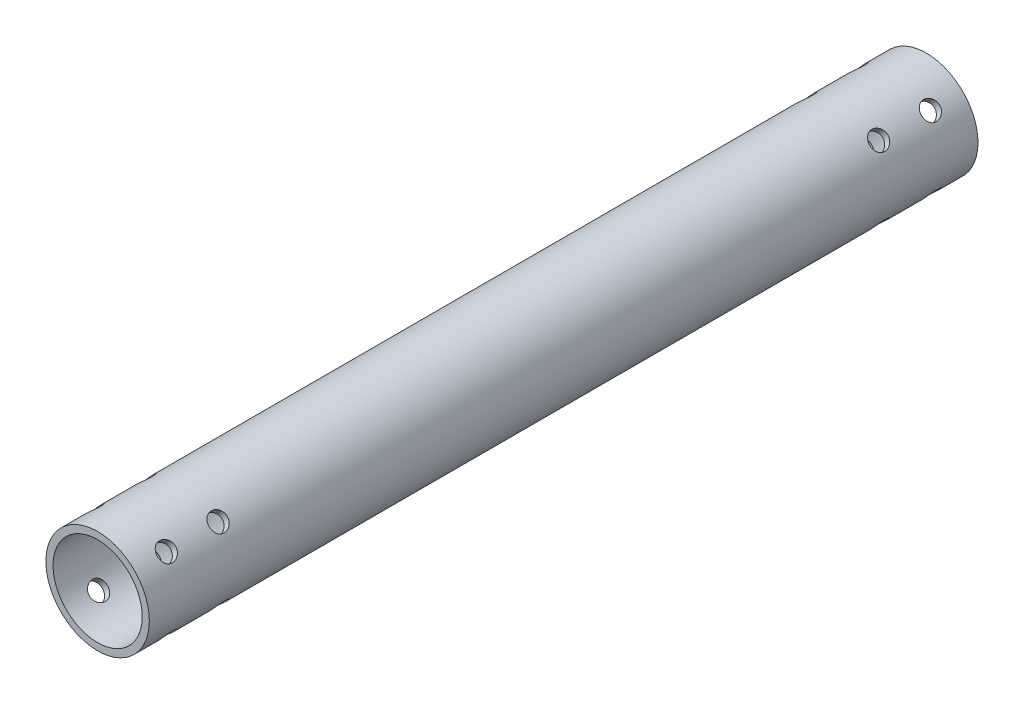
from build123d import *

# Parameters (mm, degrees)
SKETCH1_R           = 8
SKETCH1_R_2         = 6.9
BOSS_EXTRUDE1_DEPTH = 128.2
SKETCH3_R           = 1.4
CUT_EXTRUDE1_DEPTH  = 129.698251736
CIRPATTERN1_COUNT   = 2
CIRPATTERN1_ANGLE   = 90


with BuildPart() as part:
    # Sketch1 → Boss-Extrude1 (new body)
    with BuildSketch(Plane.XY):
        Circle(SKETCH1_R)
        Circle(SKETCH1_R_2, mode=Mode.SUBTRACT)
    extrude(amount=BOSS_EXTRUDE1_DEPTH)

    # Sketch3 → Cut-Extrude1 (cut, symmetric)
    with BuildSketch(Plane(origin=(0, 0, 0), x_dir=(0, 0, 1), z_dir=(-0.7071067811865488, 0.7071067811865464, 0))):
        with Locations((115.2, 0)):
            Circle(SKETCH3_R)
        with Locations((123.2, 0)):
            Circle(SKETCH3_R)
        with Locations((13, 0)):
            Circle(SKETCH3_R)
        with Locations((5, 0)):
            Circle(SKETCH3_R)
    cut_extrude1 = extrude(amount=CUT_EXTRUDE1_DEPTH, both=True, mode=Mode.SUBTRACT)

    # CirPattern1: Cut-Extrude1 ×2 about axis
    cirpattern1_axis = Axis((0, 0, -6.41), (0, 0, 1))
    for i in range(1, CIRPATTERN1_COUNT):
        add(cut_extrude1.rotate(cirpattern1_axis, i * CIRPATTERN1_ANGLE / (CIRPATTERN1_COUNT - 1)), mode=Mode.SUBTRACT)


solid = part.part
